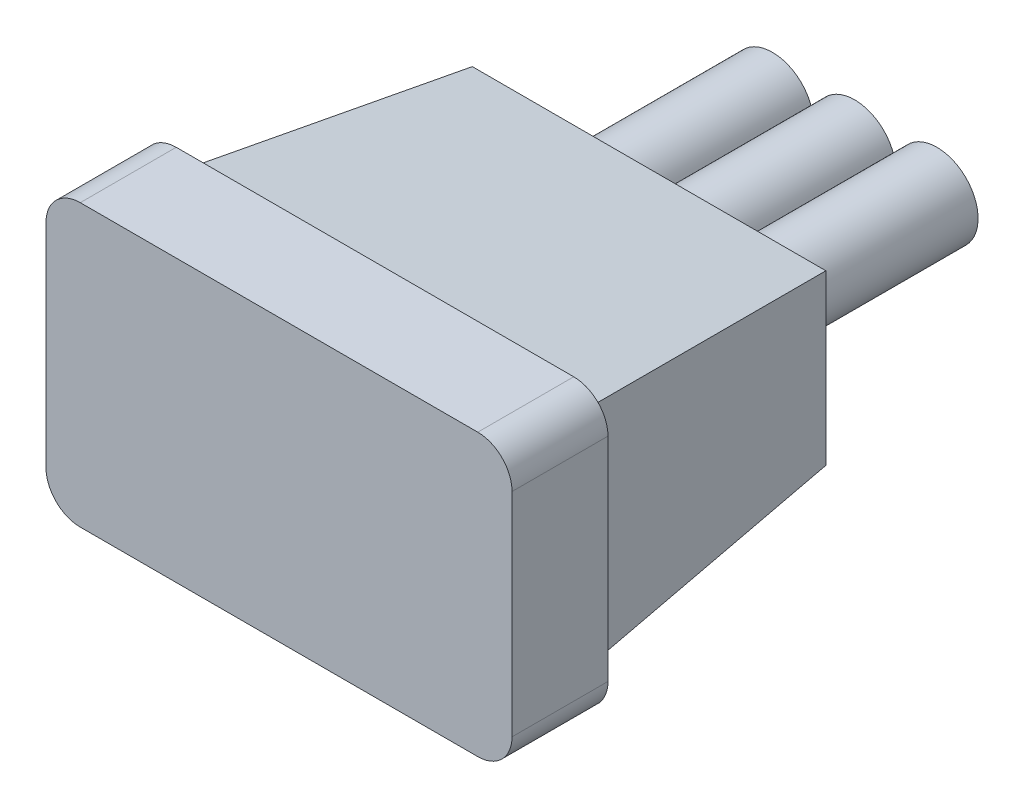
from build123d import *

# Parameters (mm, degrees)
SKETCH1_W           = 6.8
SKETCH1_H           = 4.1
BOSS_EXTRUDE1_DEPTH = 1.4
SKETCH2_W           = 6
SKETCH2_H           = 3.3
BOSS_EXTRUDE2_DEPTH = 4
BOSS_EXTRUDE2_TAPER = 6
FILLET1_R           = 0.5
SKETCH3_R           = 0.6
POSITIVE_DEPTH      = 3
SKETCH4_R           = 0.6
SIGNAL_DEPTH        = 3
SKETCH5_R           = 0.6
NEGATIVE_DEPTH      = 3


with BuildPart() as part:
    # Sketch1 → Boss-Extrude1 (new body)
    with BuildSketch(Plane.XY):
        Rectangle(SKETCH1_W, SKETCH1_H)
    extrude(amount=-BOSS_EXTRUDE1_DEPTH)

    # Sketch2 → Boss-Extrude2 (add)
    with BuildSketch(Plane(origin=(0, 0, -1.4), x_dir=(-1, 0, 0), z_dir=(0, 0, -1))):
        Rectangle(SKETCH2_W, SKETCH2_H)
    extrude(amount=BOSS_EXTRUDE2_DEPTH, taper=BOSS_EXTRUDE2_TAPER)

    # Fillet1
    fillet1_edges = [part.edges().sort_by_distance(p)[0] for p in [
        (3.4, -2.05, -0.7),
        (-3.4, -2.05, -0.7),
        (-3.4, 2.05, -0.7),
        (3.4, 2.05, -0.7),
    ]]
    fillet(fillet1_edges, radius=FILLET1_R)


with BuildPart() as body_2:
    # Sketch3 → POSITIVE (new body)
    with BuildSketch(Plane(origin=(0, 0, -5.4), x_dir=(-1, 0, 0), z_dir=(0, 0, -1))):
        Circle(SKETCH3_R)
    extrude(amount=POSITIVE_DEPTH)


with BuildPart() as body_3:
    # Sketch4 → SIGNAL (new body)
    with BuildSketch(Plane(origin=(0, 0, -5.4), x_dir=(-1, 0, 0), z_dir=(0, 0, -1))):
        with Locations((1.2, 0)):
            Circle(SKETCH4_R)
    extrude(amount=SIGNAL_DEPTH)


with BuildPart() as body_4:
    # Sketch5 → NEGATIVE (new body)
    with BuildSketch(Plane(origin=(0, 0, -5.4), x_dir=(-1, 0, 0), z_dir=(0, 0, -1))):
        with Locations((-1.2, 0)):
            Circle(SKETCH5_R)
    extrude(amount=NEGATIVE_DEPTH)


solid = Compound([part.part, body_2.part, body_3.part, body_4.part])
